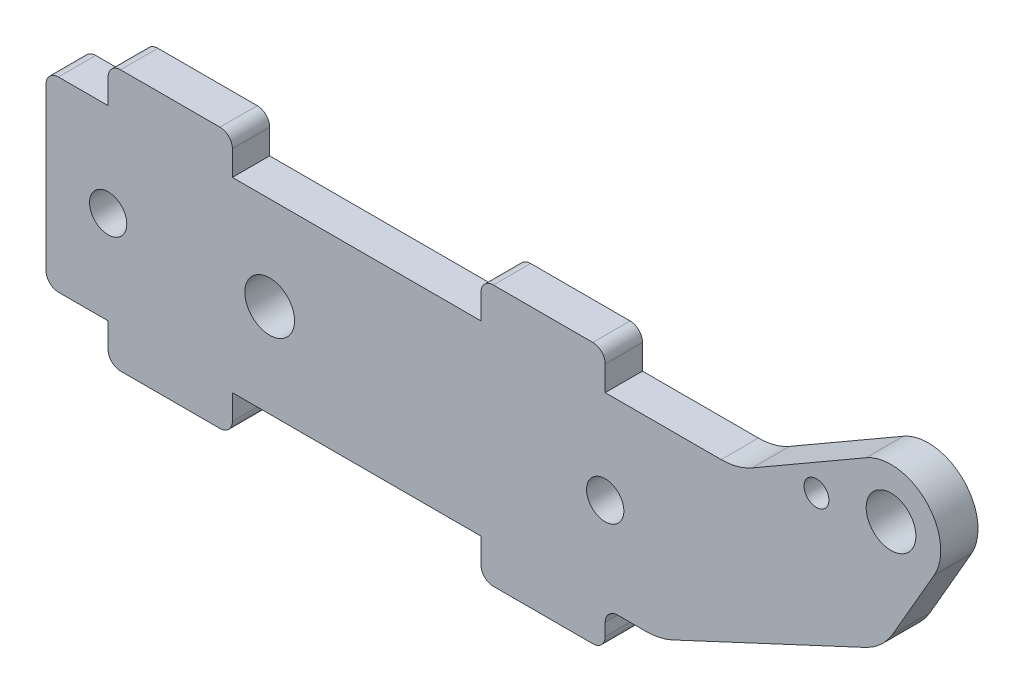
from build123d import *

# Parameters (mm, degrees)
SKETCH_1_R      = 2
SKETCH_1_R_2    = 1.5
SKETCH_1_R_3    = 1
EXTRUDE_1_DEPTH = 3
FILLET_1_R      = 1
FILLET_2_R      = 1


with BuildPart() as part:
    # 草图1 → 凸台-拉伸1 (new body)
    with BuildSketch(Plane.XY):
        with BuildLine():
            Line((0, 7.5), (5, 7.5))
            Line((5, 7.5), (5, 10.5))
            Line((5, 10.5), (15, 10.5))
            Line((15, 10.5), (15, 7.5))
            Line((15, 7.5), (35, 7.5))
            Line((35, 7.5), (35, 10.5))
            Line((35, 10.5), (45, 10.5))
            Line((45, 10.5), (45, 7.5))
            Line((45, 7.5), (54.330127019, 7.5))
            ThreePointArc((54.330127019, 7.5), (55.624222244, 7.670370869), (56.830127019, 8.169872981))
            Line((56.830127019, 8.169872981), (66, 13.464101615))
            ThreePointArc((66, 13.464101615), (70.828427125, 12.828427125), (71.464101615, 8))
            Line((71.464101615, 8), (68.134857418, 2.2335799))
            ThreePointArc((68.134857418, 2.2335799), (67.182681437, 1.047193216), (65.917821708, 0.202040965))
            Line((65.917821708, 0.202040965), (50.405359552, -7.031538935))
            ThreePointArc((50.405359552, -7.031538935), (49.374466313, -7.381480036), (48.292268243, -7.5))
            Line((48.292268243, -7.5), (45, -7.5))
            Line((45, -7.5), (45, -10.5))
            Line((45, -10.5), (35, -10.5))
            Line((35, -10.5), (35, -7.5))
            Line((35, -7.5), (15, -7.5))
            Line((15, -7.5), (15, -10.5))
            Line((15, -10.5), (5, -10.5))
            Line((5, -10.5), (5, -7.5))
            Line((5, -7.5), (0, -7.5))
            Line((0, -7.5), (0, 7.5))
        make_face()
        with Locations((68, 10)):
            Circle(SKETCH_1_R, mode=Mode.SUBTRACT)
        with Locations((5, 0)):
            Circle(SKETCH_1_R_2, mode=Mode.SUBTRACT)
        with Locations((45, 0)):
            Circle(SKETCH_1_R_2, mode=Mode.SUBTRACT)
        with Locations((18, 0)):
            Circle(SKETCH_1_R, mode=Mode.SUBTRACT)
        with Locations((62, 9)):
            Circle(SKETCH_1_R_3, mode=Mode.SUBTRACT)
    extrude(amount=EXTRUDE_1_DEPTH)

    # 圆角1
    fillet_1_edges = [part.edges().sort_by_distance(p)[0] for p in [
        (0, 7.5, 1.5),
        (5, 10.5, 1.5),
        (15, 10.5, 1.5),
        (35, 10.5, 1.5),
        (45, 10.5, 1.5),
        (45, -10.5, 1.5),
        (35, -10.5, 1.5),
        (15, -10.5, 1.5),
        (5, -10.5, 1.5),
        (0, -7.5, 1.5),
    ]]
    fillet(fillet_1_edges, radius=FILLET_1_R)

    # 圆角2
    fillet_2_edges = [part.edges().sort_by_distance(p)[0] for p in [
        (45, -7.5, 1.5),
    ]]
    fillet(fillet_2_edges, radius=FILLET_2_R)


solid = part.part
